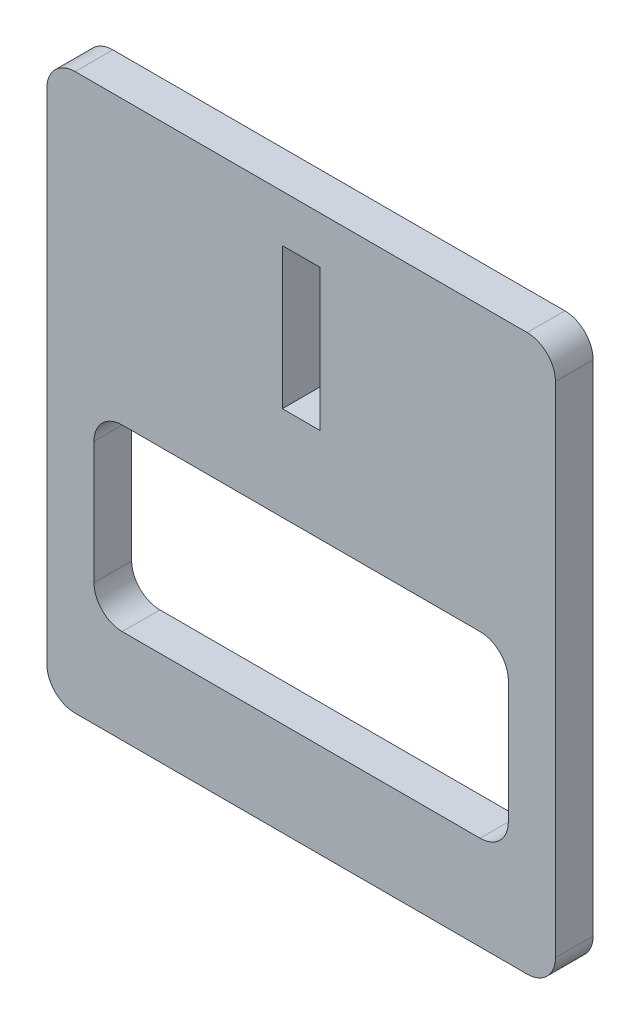
from build123d import *

# Parameters (mm, degrees)
SKETCH1_W           = 4
SKETCH1_H           = 15
BOSS_EXTRUDE1_DEPTH = 4


with BuildPart() as part:
    # Sketch1 → Boss-Extrude1 (new body)
    with BuildSketch(Plane.XY):
        with BuildLine():
            Line((-2, -10), (46, -10))
            ThreePointArc((46, -10), (48.121320344, -9.121320344), (49, -7))
            Line((49, -7), (49, 46))
            ThreePointArc((49, 46), (48.121320344, 48.121320344), (46, 49))
            Line((46, 49), (-2, 49))
            ThreePointArc((-2, 49), (-4.121320344, 48.121320344), (-5, 46))
            Line((-5, 46), (-5, -7))
            ThreePointArc((-5, -7), (-4.121320344, -9.121320344), (-2, -10))
        make_face()
        with BuildLine():
            Line((3, 0), (41, 0))
            ThreePointArc((41, 0), (43.121320344, 0.878679656), (44, 3))
            Line((44, 3), (44, 16))
            ThreePointArc((44, 16), (43.121320344, 18.121320344), (41, 19))
            Line((41, 19), (3, 19))
            ThreePointArc((3, 19), (0.878679656, 18.121320344), (0, 16))
            Line((0, 16), (0, 3))
            ThreePointArc((0, 3), (0.878679656, 0.878679656), (3, 0))
        make_face(mode=Mode.SUBTRACT)
        with Locations((22, 36.5)):
            Rectangle(SKETCH1_W, SKETCH1_H, mode=Mode.SUBTRACT)
    extrude(amount=BOSS_EXTRUDE1_DEPTH)


solid = part.part
